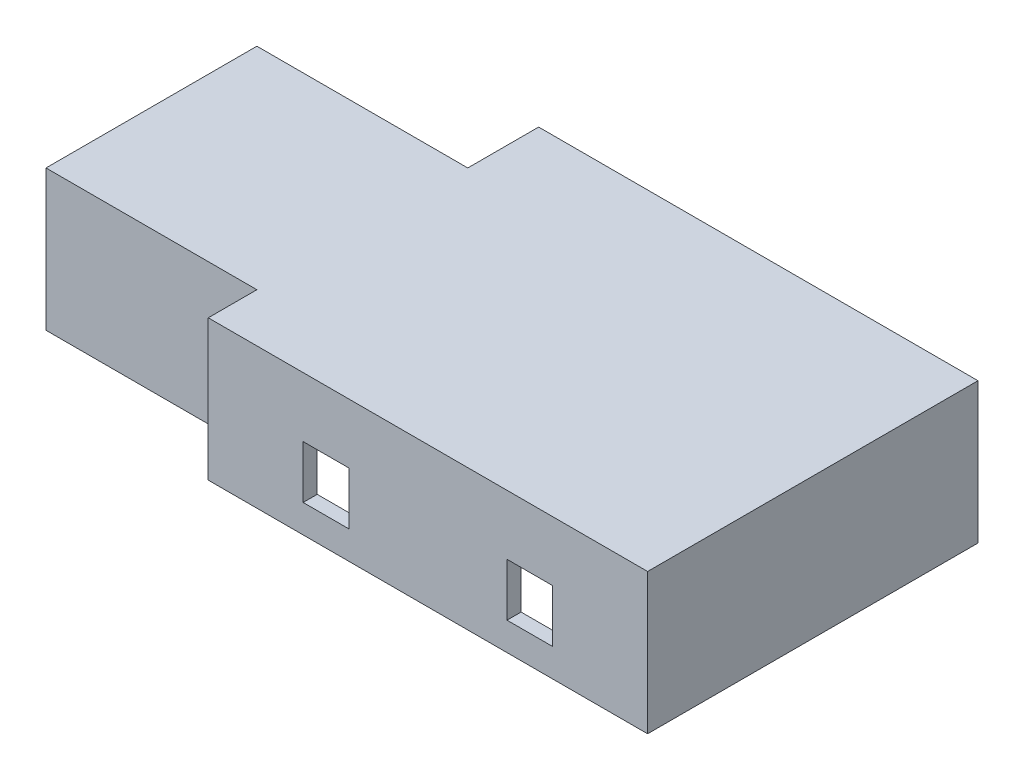
from build123d import *

# Parameters (mm, degrees)
SKETCH1_W           = 125
SKETCH1_H           = 94
BOSS_EXTRUDE1_DEPTH = 40
SKETCH2_W           = 114.291192295
SKETCH2_H           = 86
CUT_EXTRUDE1_DEPTH  = 30
CUT_EXTRUDE2_START  = 61.163706
SKETCH3_W           = 13
SKETCH3_H           = 15
CUT_EXTRUDE2_DEPTH  = 10
SKETCH4_R           = 4
BOSS_EXTRUDE2_DEPTH = 20
SKETCH5_R           = 2
CUT_EXTRUDE3_DEPTH  = 15
CUT_EXTRUDE4_START  = -38.836294
SKETCH6_W           = 45
SKETCH6_H           = 12
CUT_EXTRUDE4_DEPTH  = 10
SKETCH7_W           = 60
SKETCH7_H           = 60
BOSS_EXTRUDE3_DEPTH = 40
SKETCH8_W           = 62.296403185
SKETCH8_H           = 47.840676856
CUT_EXTRUDE5_DEPTH  = 30


with BuildPart() as part:
    # Sketch1 → Boss-Extrude1 (new body)
    with BuildSketch(Plane(origin=(0, 0, 0), x_dir=(1, 0, 0), z_dir=(0, 1, 0))):
        with Locations((11.421319797, -14.163705584)):
            Rectangle(SKETCH1_W, SKETCH1_H)
    extrude(amount=BOSS_EXTRUDE1_DEPTH)

    # Sketch2 → Cut-Extrude1 (cut)
    with BuildSketch(Plane(origin=(0, 0, 0), x_dir=(1, 0, 0), z_dir=(0, 1, 0))):
        with Locations((12.77572365, -14.163705584)):
            Rectangle(SKETCH2_W, SKETCH2_H)
    extrude(amount=CUT_EXTRUDE1_DEPTH, mode=Mode.SUBTRACT)

    # Sketch3 → Cut-Extrude2 (cut)
    with BuildSketch(Plane.XY.offset(CUT_EXTRUDE2_START)):
        with Locations((-17.578680203, 15.5)):
            Rectangle(SKETCH3_W, SKETCH3_H)
        with Locations((40.421319797, 15.5)):
            Rectangle(SKETCH3_W, SKETCH3_H)
    extrude(amount=-CUT_EXTRUDE2_DEPTH, mode=Mode.SUBTRACT)

    # Sketch4 → Boss-Extrude2 (add)
    with BuildSketch(Plane(origin=(0, 0, 0), x_dir=(1, 0, 0), z_dir=(0, 1, 0))):
        with Locations((-43.22295396, -55.91654856)):
            Circle(SKETCH4_R)
        with Locations((68.117960644, -55.91654856)):
            Circle(SKETCH4_R)
        with Locations((68.117960644, 26.819499734)):
            Circle(SKETCH4_R)
        with Locations((-43.22295396, 26.819499734)):
            Circle(SKETCH4_R)
    extrude(amount=BOSS_EXTRUDE2_DEPTH)

    # Sketch5 → Cut-Extrude3 (cut)
    with BuildSketch(Plane(origin=(0, 0, 0), x_dir=(1, 0, 0), z_dir=(0, 1, 0))):
        with Locations(Location((-43.864318676, -56.044821503, 0), (0, 0, 270))):
            Circle(SKETCH5_R)
        with Locations(Location((67.989687701, -56.044821503, 0), (0, 0, 270))):
            Circle(SKETCH5_R)
        with Locations(Location((68.117960644, 26.819499734, 0), (0, 0, 270))):
            Circle(SKETCH5_R)
        with Locations(Location((-43.864318676, 26.819499734, 0), (0, 0, 270))):
            Circle(SKETCH5_R)
    extrude(amount=CUT_EXTRUDE3_DEPTH, mode=Mode.SUBTRACT)

    # Sketch6 → Cut-Extrude4 (cut)
    with BuildSketch(Plane.XY.offset(CUT_EXTRUDE4_START)):
        with Locations((11.421319797, 20)):
            Rectangle(SKETCH6_W, SKETCH6_H)
    extrude(amount=CUT_EXTRUDE4_DEPTH, mode=Mode.SUBTRACT)

    # Sketch7 → Boss-Extrude3 (add)
    with BuildSketch(Plane(origin=(0, 0, 0), x_dir=(1, 0, 0), z_dir=(0, 1, 0))):
        with Locations((-81.078680203, -17.322261373)):
            Rectangle(SKETCH7_W, SKETCH7_H)
    extrude(amount=BOSS_EXTRUDE3_DEPTH)

    # Sketch8 → Cut-Extrude5 (cut)
    with BuildSketch(Plane(origin=(0, 0, 0), x_dir=(1, 0, 0), z_dir=(0, 1, 0))):
        with Locations((-75.518074091, -18.055506677)):
            Rectangle(SKETCH8_W, SKETCH8_H)
    extrude(amount=CUT_EXTRUDE5_DEPTH, mode=Mode.SUBTRACT)


solid = part.part
